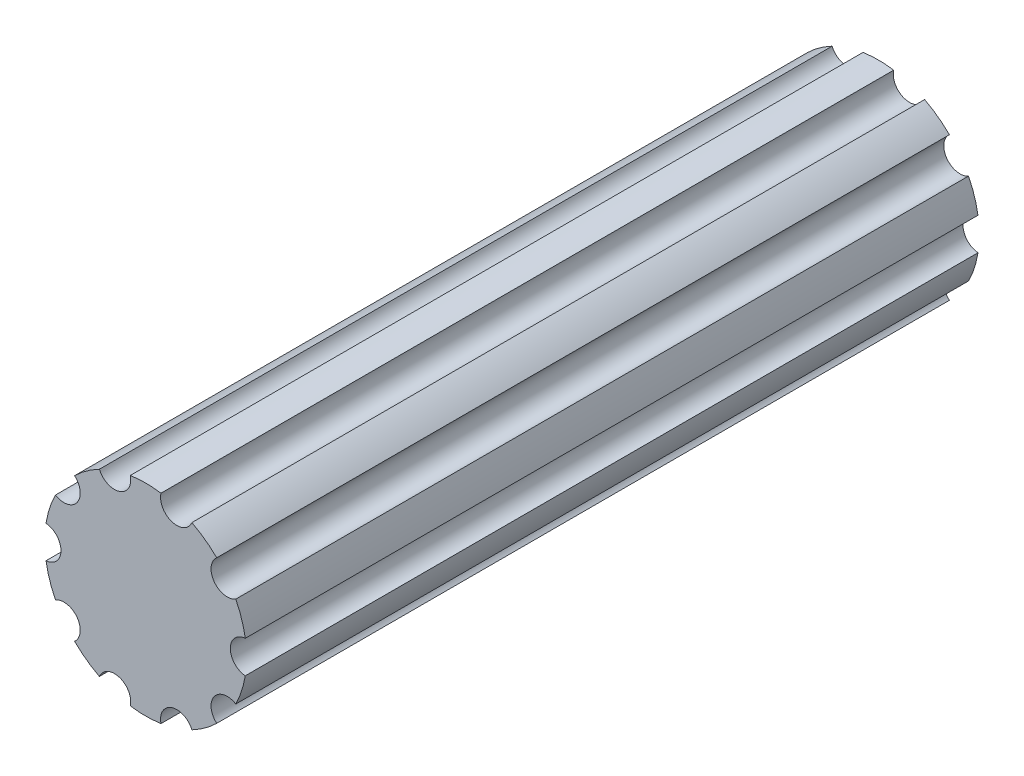
from build123d import *

# Parameters (mm, degrees)
BOSS_EXTRUDE1_DEPTH = 5.715


with BuildPart() as part:
    # Sketch1 → Boss-Extrude1 (new body)
    with BuildSketch(Plane.XY):
        with BuildLine():
            ThreePointArc((-0.360545818, 0.70000391), (-0.462822108, 0.637019981), (-0.554328495, 0.559212553))
            ThreePointArc((-0.554328495, 0.559212553), (-0.534274823, 0.388173381), (-0.703139668, 0.354391545))
            ThreePointArc((-0.703139668, 0.354391545), (-0.748861901, 0.243319981), (-0.777158065, 0.126586345))
            ThreePointArc((-0.777158065, 0.126586345), (-0.6604, 0), (-0.777158065, -0.126586345))
            ThreePointArc((-0.777158065, -0.126586345), (-0.748861901, -0.243319981), (-0.703139668, -0.354391545))
            ThreePointArc((-0.703139668, -0.354391545), (-0.534274823, -0.388173381), (-0.554328495, -0.559212553))
            ThreePointArc((-0.554328495, -0.559212553), (-0.462822108, -0.637019981), (-0.360545818, -0.70000391))
            ThreePointArc((-0.360545818, -0.70000391), (-0.204074823, -0.628077723), (-0.119764281, -0.778238573))
            ThreePointArc((-0.119764281, -0.778238573), (0, -0.7874), (0.119764281, -0.778238573))
            ThreePointArc((0.119764281, -0.778238573), (0.204074823, -0.628077723), (0.360545818, -0.70000391))
            ThreePointArc((0.360545818, -0.70000391), (0.462822108, -0.637019981), (0.554328495, -0.559212553))
            ThreePointArc((0.554328495, -0.559212553), (0.534274823, -0.388173381), (0.703139668, -0.354391545))
            ThreePointArc((0.703139668, -0.354391545), (0.748861901, -0.243319981), (0.777158065, -0.126586345))
            ThreePointArc((0.777158065, -0.126586345), (0.6604, 0), (0.777158065, 0.126586345))
            ThreePointArc((0.777158065, 0.126586345), (0.748861901, 0.243319981), (0.703139668, 0.354391545))
            ThreePointArc((0.703139668, 0.354391545), (0.534274823, 0.388173381), (0.554328495, 0.559212553))
            ThreePointArc((0.554328495, 0.559212553), (0.462822108, 0.637019981), (0.360545818, 0.70000391))
            ThreePointArc((0.360545818, 0.70000391), (0.204074823, 0.628077723), (0.119764281, 0.778238573))
            ThreePointArc((0.119764281, 0.778238573), (0, 0.7874), (-0.119764281, 0.778238573))
            ThreePointArc((-0.119764281, 0.778238573), (-0.204074823, 0.628077723), (-0.360545818, 0.70000391))
        make_face()
    extrude(amount=BOSS_EXTRUDE1_DEPTH)


solid = part.part
